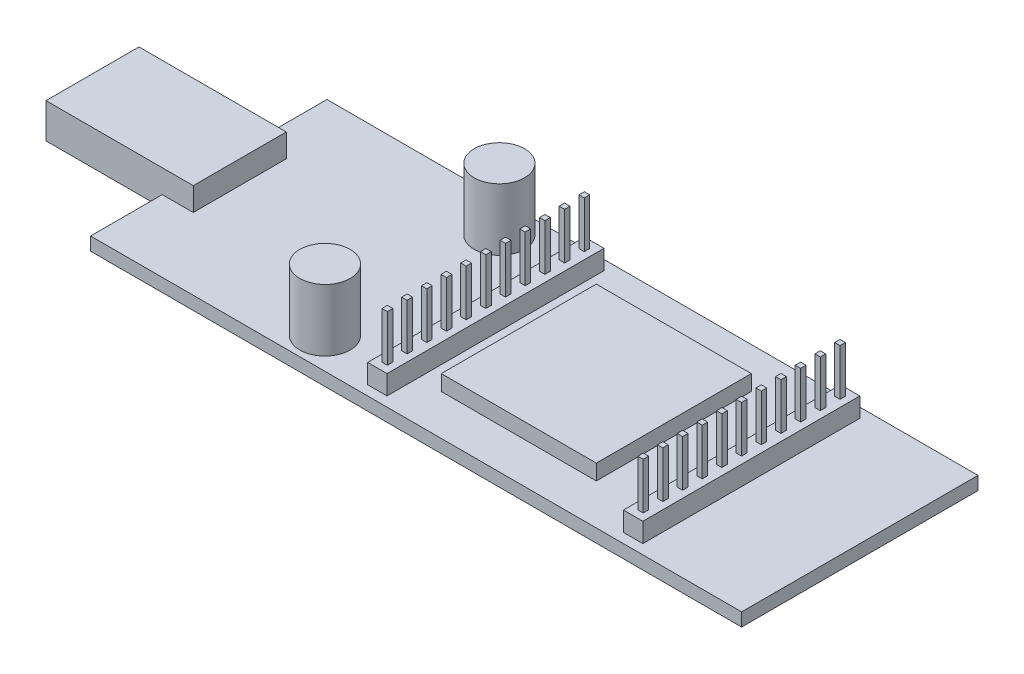
from build123d import *

# Parameters (mm, degrees)
SKETCH1_W                = 84
SKETCH1_H                = 30.5
BOSS_EXTRUDE1_DEPTH      = 1.7
BOSS_EXTRUDE2_DEPTH      = 3
BOSS_EXTRUDE2_DEPTH_BACK = 1.5
SKETCH2_W                = 19
SKETCH2_H                = 12
SKETCH3_W                = 20
SKETCH3_H                = 20
BOSS_EXTRUDE3_DEPTH      = 2
SKETCH4_W                = 5.627780268
SKETCH4_H                = 4.971205903
SKETCH4_W_2              = 9.661022794
SKETCH4_H_2              = 4.502224215
SKETCH4_W_3              = 9.473430118
SKETCH4_H_3              = 8.629263078
SKETCH4_W_4              = 9.942411808
SKETCH4_H_4              = 7.503707025
BOSS_EXTRUDE4_DEPTH      = 2
SKETCH5_R                = 3.25
BOSS_EXTRUDE5_DEPTH      = 8
SKETCH6_W                = 2.5
SKETCH6_H                = 28
BOSS_EXTRUDE6_DEPTH      = 2.5
SKETCH7_W                = 0.7
SKETCH7_H                = 0.7
BOSS_EXTRUDE7_DEPTH      = 6


with BuildPart() as part:
    # Sketch1 → Boss-Extrude1 (new body)
    with BuildSketch(Plane(origin=(0, 0, 0), x_dir=(1, 0, 0), z_dir=(0, 1, 0))):
        Rectangle(SKETCH1_W, SKETCH1_H)
    extrude(amount=BOSS_EXTRUDE1_DEPTH)

    # Sketch2 → Boss-Extrude2 (add, two sides: drawn at the far end of the back side and taken through both)
    with BuildSketch(Plane(origin=(0, 1.7, 0), x_dir=(1, 0, 0), z_dir=(0, 1, 0)).offset(-BOSS_EXTRUDE2_DEPTH_BACK)):
        with Locations((-47.5, 0)):
            Rectangle(SKETCH2_W, SKETCH2_H)
    extrude(amount=BOSS_EXTRUDE2_DEPTH + BOSS_EXTRUDE2_DEPTH_BACK)

    # Sketch3 → Boss-Extrude3 (add)
    with BuildSketch(Plane(origin=(0, 1.7, 0), x_dir=(1, 0, 0), z_dir=(0, 1, 0))):
        with Locations((8, 0)):
            Rectangle(SKETCH3_W, SKETCH3_H)
    extrude(amount=BOSS_EXTRUDE3_DEPTH)

    # Sketch4 → Boss-Extrude4 (add)
    with BuildSketch(Plane.XZ):
        with Locations((-33.387789234, 9.379633781)):
            Rectangle(SKETCH4_W, SKETCH4_H)
        with Locations((-21.288061657, -3.048380979)):
            Rectangle(SKETCH4_W_2, SKETCH4_H_2)
        with Locations((15.5738991, 8.160281389)):
            Rectangle(SKETCH4_W_3, SKETCH4_H_3)
        with Locations((9.805424325, -4.642918722)):
            Rectangle(SKETCH4_W_4, SKETCH4_H_4)
    extrude(amount=BOSS_EXTRUDE4_DEPTH)

    # Sketch5 → Boss-Extrude5 (add)
    with BuildSketch(Plane(origin=(0, 1.7, 0), x_dir=(1, 0, 0), z_dir=(0, 1, 0))):
        with Locations(Location((-15.754077727, 11.25, 0), (0, 0, 270))):
            Circle(SKETCH5_R)
        with Locations(Location((-15.754077727, -11.25, 0), (0, 0, 90))):
            Circle(SKETCH5_R)
    extrude(amount=BOSS_EXTRUDE5_DEPTH)

    # Sketch6 → Boss-Extrude6 (add)
    with BuildSketch(Plane(origin=(0, 1.7, 0), x_dir=(1, 0, 0), z_dir=(0, 1, 0))):
        with Locations((-6.25, 0)):
            Rectangle(SKETCH6_W, SKETCH6_H)
        with Locations((26.75, 0)):
            Rectangle(SKETCH6_W, SKETCH6_H)
    extrude(amount=BOSS_EXTRUDE6_DEPTH)

    # Sketch7 → Boss-Extrude7 (add)
    with BuildSketch(Plane(origin=(0, 4.2, 0), x_dir=(1, 0, 0), z_dir=(0, 1, 0))):
        with Locations((-6.25, 2.54)):
            Rectangle(SKETCH7_W, SKETCH7_H)
        with Locations((-6.25, 0)):
            Rectangle(SKETCH7_W, SKETCH7_H)
        with Locations((-6.25, 5.08)):
            Rectangle(SKETCH7_W, SKETCH7_H)
        with Locations((-6.25, 7.62)):
            Rectangle(SKETCH7_W, SKETCH7_H)
        with Locations((-6.25, 10.16)):
            Rectangle(SKETCH7_W, SKETCH7_H)
        with Locations((-6.25, 12.7)):
            Rectangle(SKETCH7_W, SKETCH7_H)
        with Locations((-6.25, -2.54)):
            Rectangle(SKETCH7_W, SKETCH7_H)
        with Locations((-6.25, -5.08)):
            Rectangle(SKETCH7_W, SKETCH7_H)
        with Locations((-6.25, -7.62)):
            Rectangle(SKETCH7_W, SKETCH7_H)
        with Locations((-6.25, -10.16)):
            Rectangle(SKETCH7_W, SKETCH7_H)
        with Locations((-6.25, -12.7)):
            Rectangle(SKETCH7_W, SKETCH7_H)
        with Locations((26.75, 2.54)):
            Rectangle(SKETCH7_W, SKETCH7_H)
        with Locations((26.75, 10.16)):
            Rectangle(SKETCH7_W, SKETCH7_H)
        with Locations((26.75, -12.7)):
            Rectangle(SKETCH7_W, SKETCH7_H)
        with Locations((26.75, -2.54)):
            Rectangle(SKETCH7_W, SKETCH7_H)
        with Locations((26.75, 7.62)):
            Rectangle(SKETCH7_W, SKETCH7_H)
        with Locations((26.75, 12.7)):
            Rectangle(SKETCH7_W, SKETCH7_H)
        with Locations((26.75, 0)):
            Rectangle(SKETCH7_W, SKETCH7_H)
        with Locations((26.75, -5.08)):
            Rectangle(SKETCH7_W, SKETCH7_H)
        with Locations((26.75, -10.16)):
            Rectangle(SKETCH7_W, SKETCH7_H)
        with Locations((26.75, -7.62)):
            Rectangle(SKETCH7_W, SKETCH7_H)
        with Locations((26.75, 5.08)):
            Rectangle(SKETCH7_W, SKETCH7_H)
    extrude(amount=BOSS_EXTRUDE7_DEPTH)


solid = part.part
